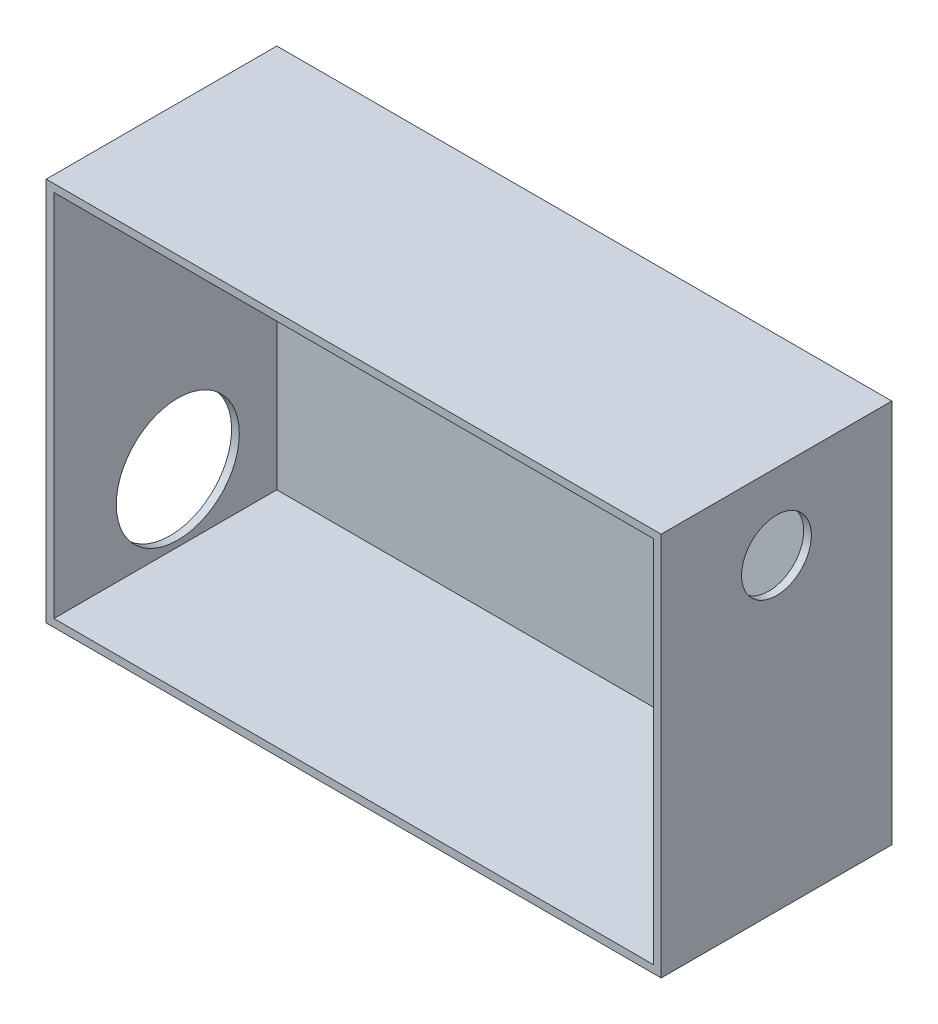
from build123d import *

# Parameters (mm, degrees)
SKETCH_1_W          = 80
SKETCH_1_H          = 50
EXTRUDE_1_DEPTH     = 30
SHELL_1_T           = -1
SKETCH_3_R          = 4.539465833
CUT_EXTRUDE_1_DEPTH = 30
SKETCH_4_R          = 8
CUT_EXTRUDE_2_DEPTH = 30


with BuildPart() as part:
    # 草图1 → 凸台-拉伸1 (new body)
    with BuildSketch(Plane.XY):
        Rectangle(SKETCH_1_W, SKETCH_1_H)
    extrude(amount=EXTRUDE_1_DEPTH)

    # 抽壳1
    shell_1_openings = [part.faces().sort_by_distance(p)[0] for p in [
        (0, 0, 30),
    ]]
    offset(amount=SHELL_1_T, openings=shell_1_openings, kind=Kind.INTERSECTION)

    # 草图3 → 切除-拉伸1 (cut)
    with BuildSketch(Plane(origin=(40, 0, 0), x_dir=(0, 0, -1), z_dir=(1, 0, 0))):
        with Locations((-15, 15.117251004)):
            Circle(SKETCH_3_R)
    extrude(amount=-CUT_EXTRUDE_1_DEPTH, mode=Mode.SUBTRACT)

    # 草图4 → 切除-拉伸2 (cut)
    with BuildSketch(Plane.ZY.offset(40)):
        with Locations(Location((13.881500003, -15.22906305, 0), (0, 0, 270))):
            Circle(SKETCH_4_R)
    extrude(amount=-CUT_EXTRUDE_2_DEPTH, mode=Mode.SUBTRACT)


solid = part.part
